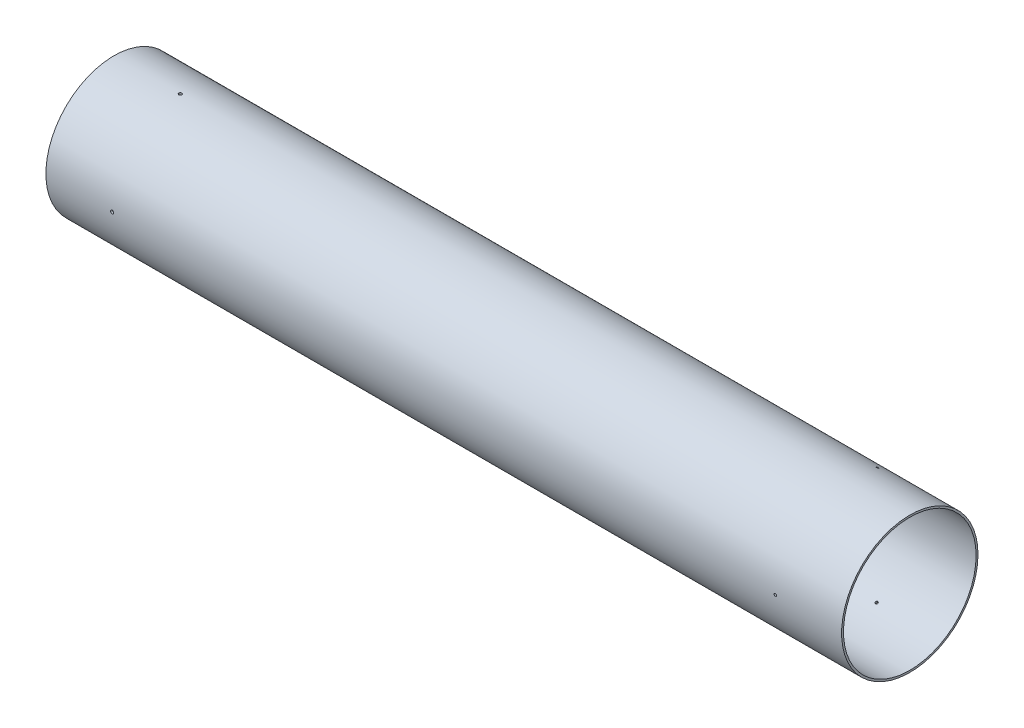
from build123d import *

# Parameters (mm, degrees)
SKETCH3_R               = 78.359
SKETCH3_R_2             = 76.2
BOSS_EXTRUDE1_DEPTH     = 914.4
CUT_EXTRUDE1_REACH      = 923.09
CUT_EXTRUDE1_END_RADIUS = 78.359
SKETCH4_R               = 1.41224
CIRPATTERN1_COUNT       = 3
CUT_EXTRUDE2_REACH      = 923.09
CUT_EXTRUDE2_END_RADIUS = 78.359
SKETCH5_R               = 1.7859375
CIRPATTERN2_COUNT       = 4


with BuildPart() as part:
    # Sketch3 → Boss-Extrude1 (new body)
    with BuildSketch(Plane(origin=(0, 0, 0), x_dir=(0, 0, -1), z_dir=(1, 0, 0))):
        Circle(SKETCH3_R)
        Circle(SKETCH3_R_2, mode=Mode.SUBTRACT)
    extrude(amount=BOSS_EXTRUDE1_DEPTH)

    # Cut-Extrude1: up to this cylinder (the profile starts inside it)
    cut_extrude1_end = Plane(origin=(838.2, 0, 0), z_dir=(-1, 0, 0)) * Cylinder(CUT_EXTRUDE1_END_RADIUS, 2003.898, mode=Mode.PRIVATE)
    # Sketch4 → Cut-Extrude1 (cut, up to the surface)
    with BuildSketch(Plane.XY, mode=Mode.PRIVATE) as cut_extrude1_sk1:
        with Locations(Location((838.2, 0, 0), (0, 0, 180))):
            Circle(SKETCH4_R)
    cut_extrude1_tool1 = extrude(cut_extrude1_sk1.sketch, amount=CUT_EXTRUDE1_REACH, mode=Mode.PRIVATE) & cut_extrude1_end
    cut_extrude1 = cut_extrude1_tool1.solids().sort_by_distance((838.2, 0, 0))[0]
    add(cut_extrude1, mode=Mode.SUBTRACT)

    # CirPattern1: Cut-Extrude1 ×3 about axis
    cirpattern1_axis = Axis((914.4, 0, 0), (1, 0, 0))
    for i in range(1, CIRPATTERN1_COUNT):
        add(cut_extrude1.rotate(cirpattern1_axis, i * 360 / CIRPATTERN1_COUNT), mode=Mode.SUBTRACT)

    # Cut-Extrude2: up to this cylinder (the profile starts inside it)
    cut_extrude2_end = Plane(origin=(76.2, 0, 0), z_dir=(-1, 0, 0)) * Cylinder(CUT_EXTRUDE2_END_RADIUS, 2003.898, mode=Mode.PRIVATE)
    # Sketch5 → Cut-Extrude2 (cut, up to the surface)
    with BuildSketch(Plane.XY, mode=Mode.PRIVATE) as cut_extrude2_sk1:
        with Locations(Location((76.2, 0, 0), (0, 0, 180))):
            Circle(SKETCH5_R)
    cut_extrude2_tool1 = extrude(cut_extrude2_sk1.sketch, amount=CUT_EXTRUDE2_REACH, mode=Mode.PRIVATE) & cut_extrude2_end
    cut_extrude2 = cut_extrude2_tool1.solids().sort_by_distance((76.2, 0, 0))[0]
    add(cut_extrude2, mode=Mode.SUBTRACT)

    # CirPattern2: Cut-Extrude2 ×4 about axis
    cirpattern2_axis = Axis((0, 0, 0), (1, 0, 0))
    for i in range(1, CIRPATTERN2_COUNT):
        add(cut_extrude2.rotate(cirpattern2_axis, i * 360 / CIRPATTERN2_COUNT), mode=Mode.SUBTRACT)


solid = part.part
